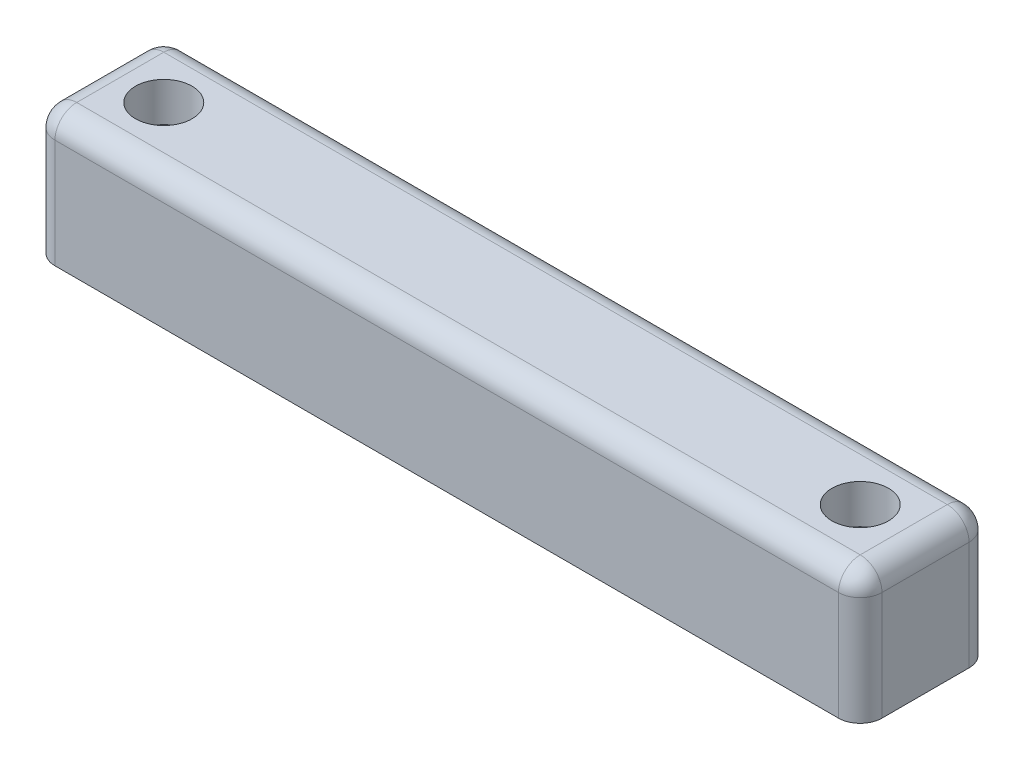
from build123d import *

# Parameters (mm, degrees)
SKETCH1_W                                           = 190
SKETCH1_H                                           = 30
BOSS_EXTRUDE1_DEPTH                                 = 15
FILLET3_R                                           = 5
CBORE_FOR_M6_HEX_SOCKET_HEAD_CAP_SCREW1_D           = 6.6
CBORE_FOR_M6_HEX_SOCKET_HEAD_CAP_SCREW1_CBORE_D     = 13
CBORE_FOR_M6_HEX_SOCKET_HEAD_CAP_SCREW1_CBORE_DEPTH = 9


with BuildPart() as part:
    # Sketch1 → Boss-Extrude1 (new, symmetric)
    with BuildSketch(Plane.XY):
        Rectangle(SKETCH1_W, SKETCH1_H)
    extrude(amount=BOSS_EXTRUDE1_DEPTH, both=True)

    # Fillet3
    fillet3_edges = [part.edges().sort_by_distance(p)[0] for p in [
        (95, 0, 15),
        (0, 15, 15),
        (-95, 0, 15),
        (0, 15, -15),
        (95, 0, -15),
        (-95, 0, -15),
        (-95, 15, 0),
        (95, 15, 0),
    ]]
    fillet(fillet3_edges, radius=FILLET3_R)

    # CBORE for M6 Hex Socket Head Cap Screw1 (through all)
    with Locations(Plane(origin=(0, 15, 0), x_dir=(1, 0, 0), z_dir=(0, 1, 0))):
        with Locations((-80, 0), (80, 0)):
            CounterBoreHole(CBORE_FOR_M6_HEX_SOCKET_HEAD_CAP_SCREW1_D / 2, CBORE_FOR_M6_HEX_SOCKET_HEAD_CAP_SCREW1_CBORE_D / 2, CBORE_FOR_M6_HEX_SOCKET_HEAD_CAP_SCREW1_CBORE_DEPTH)


solid = part.part
